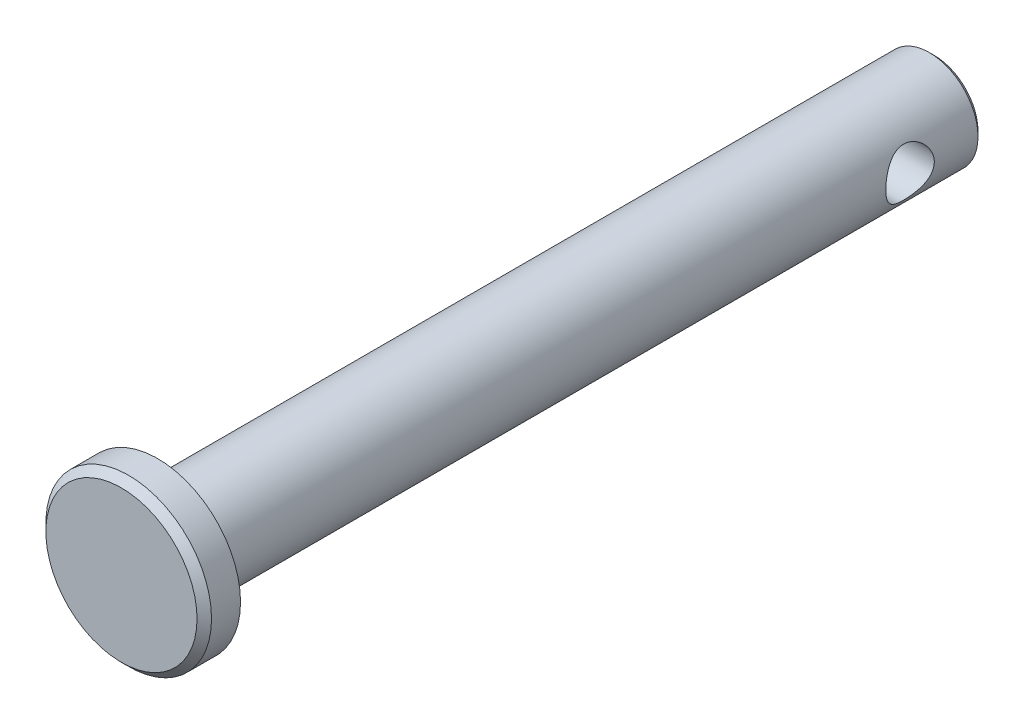
from build123d import *

# Parameters (mm, degrees)
SKETCH1_R           = 2.38125
EXTRUDE1_DEPTH      = 19.05
SKETCH2_R           = 4.064
EXTRUDE2_DEPTH      = 1.778
CHAMFER1_SIZE       = 0.3556
EXTRUDE3_DEPTH      = 22.606429043
EXTRUDE3_DEPTH_BACK = 22.606429043
SKETCH3_R           = 1.190625
CHAMFER2_SIZE       = 0.238125


with BuildPart() as part:
    # Sketch1 → Extrude1 (new, symmetric)
    with BuildSketch(Plane.XY):
        with Locations(Location((0, 0, 0), (0, 0, 180))):
            Circle(SKETCH1_R)
    extrude(amount=EXTRUDE1_DEPTH, both=True)

    # Sketch2 → Extrude2 (add)
    with BuildSketch(Plane.XY.offset(19.05)):
        Circle(SKETCH2_R)
    extrude(amount=EXTRUDE2_DEPTH)

    # Chamfer1
    chamfer1_edges = [part.edges().sort_by_distance(p)[0] for p in [
        (-4.064, 0, 20.828),
    ]]
    chamfer(chamfer1_edges, length=CHAMFER1_SIZE)

    # Sketch3 → Extrude3 (cut, two sides: drawn at the far end of the back side and taken through both)
    with BuildSketch(Plane(origin=(0, 0, 0), x_dir=(0, 0, -1), z_dir=(1, 0, 0)).offset(-EXTRUDE3_DEPTH_BACK)):
        with Locations(Location((15.478125, 0, 0), (0, 0, 179.999999999))):
            Circle(SKETCH3_R)
    extrude(amount=EXTRUDE3_DEPTH + EXTRUDE3_DEPTH_BACK, mode=Mode.SUBTRACT)

    # Chamfer2
    chamfer2_edges = [part.edges().sort_by_distance(p)[0] for p in [
        (2.38125, 0, -19.05),
    ]]
    chamfer(chamfer2_edges, length=CHAMFER2_SIZE)


solid = part.part
